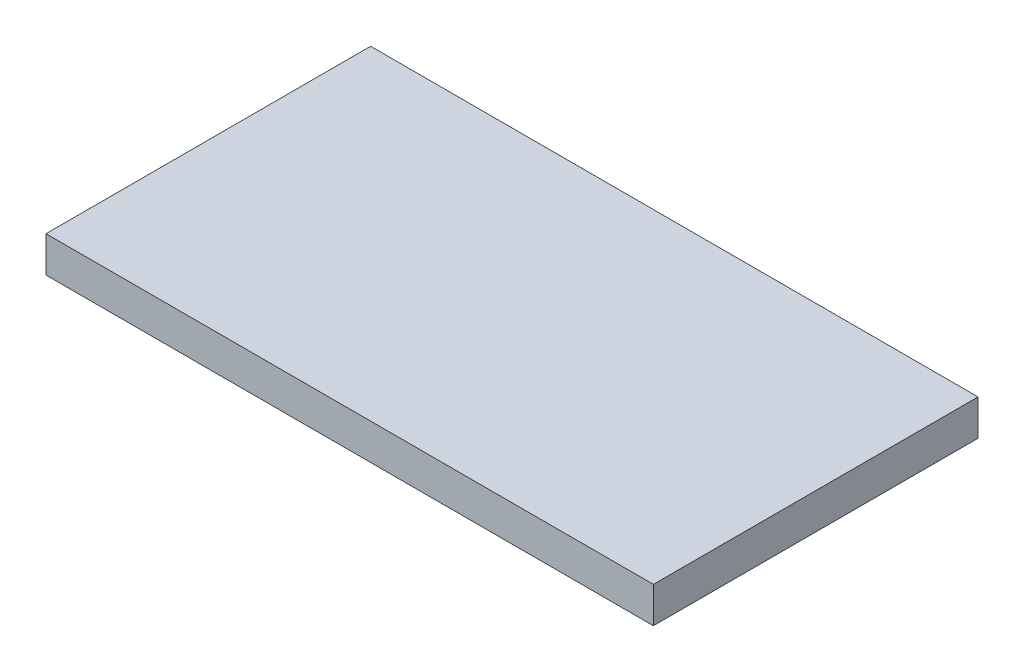
from build123d import *

# Parameters (mm, degrees)
SKETCH1_W           = 43.063896912
SKETCH1_H           = 23.016910418
BOSS_EXTRUDE1_DEPTH = 2.54


with BuildPart() as part:
    # Sketch1 → Boss-Extrude1 (new body)
    with BuildSketch(Plane(origin=(0, 0, 0), x_dir=(1, 0, 0), z_dir=(0, 1, 0))):
        Rectangle(SKETCH1_W, SKETCH1_H)
    extrude(amount=BOSS_EXTRUDE1_DEPTH)


solid = part.part
